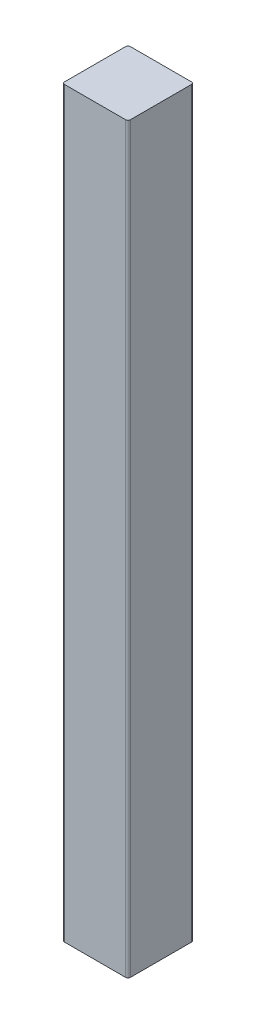
from build123d import *

# Parameters (mm, degrees)
SKETCH1_W           = 88.9
SKETCH1_H           = 88.9
BOSS_EXTRUDE1_DEPTH = 1004.8875
FILLET1_R           = 3.175


with BuildPart() as part:
    # Sketch1 → Boss-Extrude1 (new body)
    with BuildSketch(Plane(origin=(0, 0, 0), x_dir=(1, 0, 0), z_dir=(0, 1, 0))):
        Rectangle(SKETCH1_W, SKETCH1_H)
    extrude(amount=BOSS_EXTRUDE1_DEPTH)

    # Fillet1
    fillet1_edges = [part.edges().sort_by_distance(p)[0] for p in [
        (44.45, 502.44375, 44.45),
        (-44.45, 502.44375, 44.45),
        (-44.45, 502.44375, -44.45),
        (44.45, 502.44375, -44.45),
    ]]
    fillet(fillet1_edges, radius=FILLET1_R)


solid = part.part
